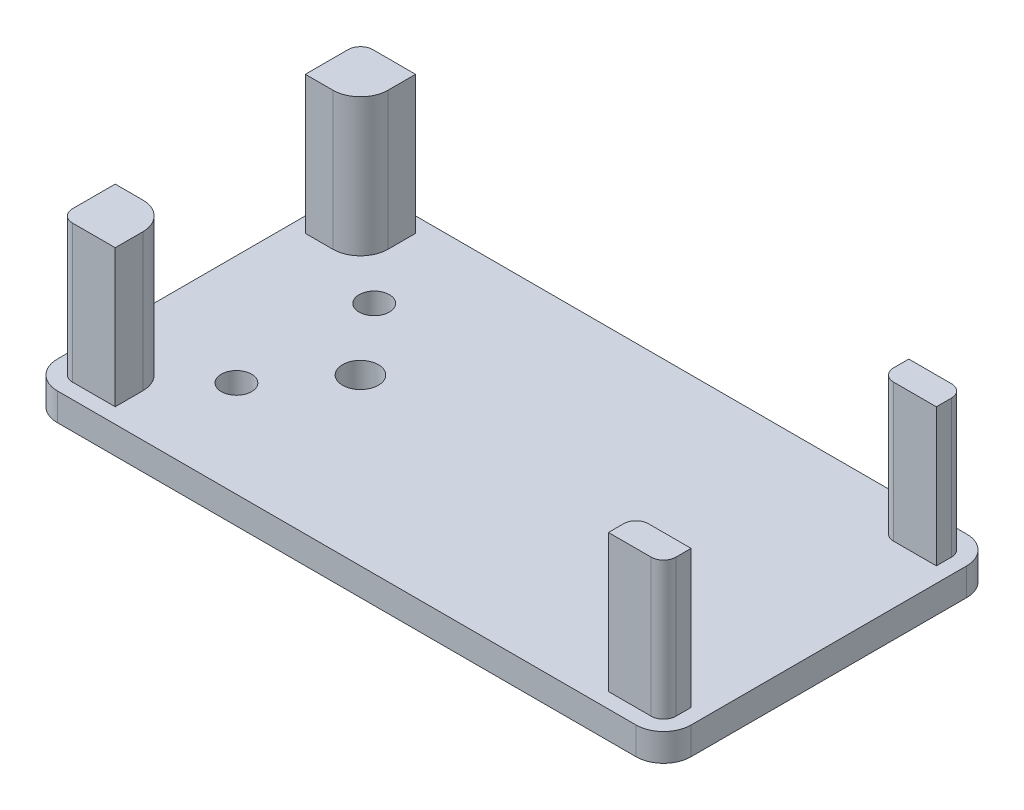
from build123d import *

# Parameters (mm, degrees)
SKETCH1_W           = 111.76
SKETCH1_H           = 60.96
BOSS_EXTRUDE1_DEPTH = 5.08
FILLET1_R           = 5.08
CUT_EXTRUDE1_REACH  = 129.406
SKETCH3_R           = 2.794
SKETCH3_R_2         = 3.302
SKETCH5_W           = 10.16
SKETCH5_H           = 60.96
BOSS_EXTRUDE2_DEPTH = 5.08
FILLET2_R           = 5.08
SKETCH2_W           = 10.16
SKETCH2_H           = 10.16
SKETCH2_H_2         = 5.08
BOSS_EXTRUDE5_DEPTH = 25.4
FILLET9_R           = 2.286
FILLET10_R          = 5.08


with BuildPart() as part:
    # Sketch1 → Boss-Extrude1 (new body)
    with BuildSketch(Plane(origin=(0, 0, 0), x_dir=(1, 0, 0), z_dir=(0, 1, 0))):
        with Locations((55.88, 30.48)):
            Rectangle(SKETCH1_W, SKETCH1_H)
    extrude(amount=BOSS_EXTRUDE1_DEPTH)

    # Fillet1
    fillet1_edges = [part.edges().sort_by_distance(p)[0] for p in [
        (0, 2.54, -60.96),
        (111.76, 2.54, -60.96),
        (111.76, 2.54, 0),
        (0, 2.54, 0),
    ]]
    fillet(fillet1_edges, radius=FILLET1_R)

    # Sketch3 → Cut-Extrude1 (cut, up to next)
    with BuildSketch(Plane.XZ, mode=Mode.PRIVATE) as cut_extrude1_sk1:
        with Locations(Location((20.32, -17.78, 0), (0, 0, 270))):
            Circle(SKETCH3_R)
    cut_extrude1_tool1 = extrude(cut_extrude1_sk1.sketch, amount=-CUT_EXTRUDE1_REACH, mode=Mode.PRIVATE) & part.part
    # Sketch3 → Cut-Extrude1 (cut, up to next)
    with BuildSketch(Plane.XZ, mode=Mode.PRIVATE) as cut_extrude1_sk2:
        with Locations(Location((20.32, -43.18, 0), (0, 0, 270))):
            Circle(SKETCH3_R)
    cut_extrude1_tool2 = extrude(cut_extrude1_sk2.sketch, amount=-CUT_EXTRUDE1_REACH, mode=Mode.PRIVATE) & part.part
    # Sketch3 → Cut-Extrude1 (cut, up to next)
    with BuildSketch(Plane.XZ, mode=Mode.PRIVATE) as cut_extrude1_sk3:
        with Locations(Location((30.48, -30.48, 0), (0, 0, 270))):
            Circle(SKETCH3_R_2)
    cut_extrude1_tool3 = extrude(cut_extrude1_sk3.sketch, amount=-CUT_EXTRUDE1_REACH, mode=Mode.PRIVATE) & part.part
    add(cut_extrude1_tool1.solids().sort_by_distance((20.32, 0, -17.78))[0], mode=Mode.SUBTRACT)
    add(cut_extrude1_tool2.solids().sort_by_distance((20.32, 0, -43.18))[0], mode=Mode.SUBTRACT)
    add(cut_extrude1_tool3.solids().sort_by_distance((30.48, 0, -30.48))[0], mode=Mode.SUBTRACT)

    # Sketch5 → Boss-Extrude2 (add)
    with BuildSketch(Plane.XZ):
        with Locations((111.76, -30.48)):
            Rectangle(SKETCH5_W, SKETCH5_H)
    extrude(amount=-BOSS_EXTRUDE2_DEPTH)

    # Fillet2
    fillet2_edges = [part.edges().sort_by_distance(p)[0] for p in [
        (116.84, 2.54, 0),
        (116.84, 2.54, -60.96),
    ]]
    fillet(fillet2_edges, radius=FILLET2_R)

    # Sketch2 → Boss-Extrude5 (add)
    with BuildSketch(Plane(origin=(0, 5.08, 0), x_dir=(1, 0, 0), z_dir=(0, 1, 0))):
        with Locations((7.874, 53.086)):
            Rectangle(SKETCH2_W, SKETCH2_H)
        with Locations((7.874, 7.874)):
            Rectangle(SKETCH2_W, SKETCH2_H)
        with Locations((108.966, 55.626)):
            Rectangle(SKETCH2_W, SKETCH2_H_2)
        with Locations((108.966, 5.334)):
            Rectangle(SKETCH2_W, SKETCH2_H_2)
    extrude(amount=BOSS_EXTRUDE5_DEPTH)

    # Fillet9
    fillet9_edges = [part.edges().sort_by_distance(p)[0] for p in [
        (103.886, 17.78, -7.874),
        (114.046, 17.78, -2.794),
        (2.794, 17.78, -2.794),
        (2.794, 17.78, -58.166),
        (103.886, 17.78, -53.086),
        (114.046, 17.78, -58.166),
    ]]
    fillet(fillet9_edges, radius=FILLET9_R)

    # Fillet10
    fillet10_edges = [part.edges().sort_by_distance(p)[0] for p in [
        (12.954, 17.78, -12.954),
        (12.954, 17.78, -48.006),
    ]]
    fillet(fillet10_edges, radius=FILLET10_R)


solid = part.part
